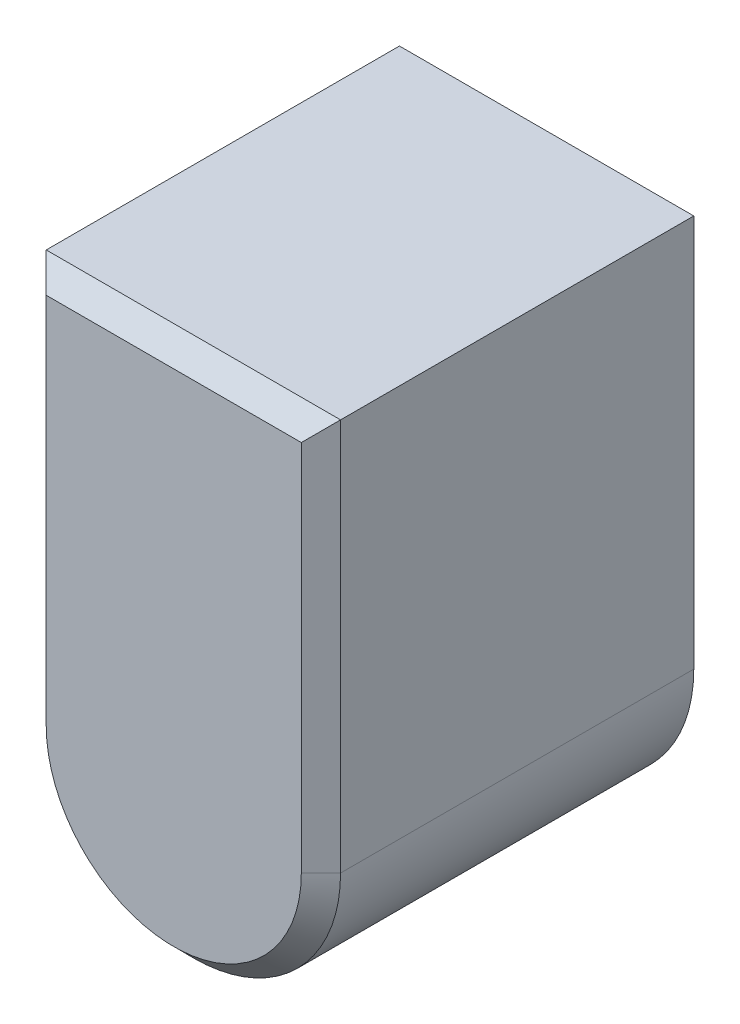
from build123d import *

# Parameters (mm, degrees)
EXTRUDE_1_DEPTH     = 4
CUT_EXTRUDE_1_REACH = 7.523
CHAMFER_1_SIZE      = 0.2


with BuildPart() as part:
    # 草图1 → 凸台-拉伸1 (new body)
    with BuildSketch(Plane.XY):
        with BuildLine():
            Line((-1.5, -2), (-1.5, 2))
            ThreePointArc((-1.5, 2), (0, 3.5), (1.5, 2))
            Line((1.5, 2), (1.5, -2))
            ThreePointArc((1.5, -2), (0, -3.5), (-1.5, -2))
        make_face()
    extrude(amount=EXTRUDE_1_DEPTH)

    # 草图2 → 切除-拉伸1 (cut, up to next)
    with BuildSketch(Plane.XY.offset(4), mode=Mode.PRIVATE) as cut_extrude_1_sk1:
        with BuildLine():
            Line((-1.5, 2), (1.5, 2))
            ThreePointArc((1.5, 2), (0, 3.5), (-1.5, 2))
        make_face()
    cut_extrude_1_tool1 = extrude(cut_extrude_1_sk1.sketch, amount=-CUT_EXTRUDE_1_REACH, mode=Mode.PRIVATE) & part.part
    add(cut_extrude_1_tool1.solids().sort_by_distance((0, 2.63662, 4))[0], mode=Mode.SUBTRACT)

    # 倒角1
    chamfer_1_edges = [part.edges().sort_by_distance(p)[0] for p in [
        (0, 2, 4),
        (-1.5, 0, 4),
        (0, 2, 0),
        (0, -3.5, 4),
        (-1.5, 0, 0),
        (1.5, 0, 0),
        (0, -3.5, 0),
        (1.5, 0, 4),
    ]]
    chamfer(chamfer_1_edges, length=CHAMFER_1_SIZE)


solid = part.part
